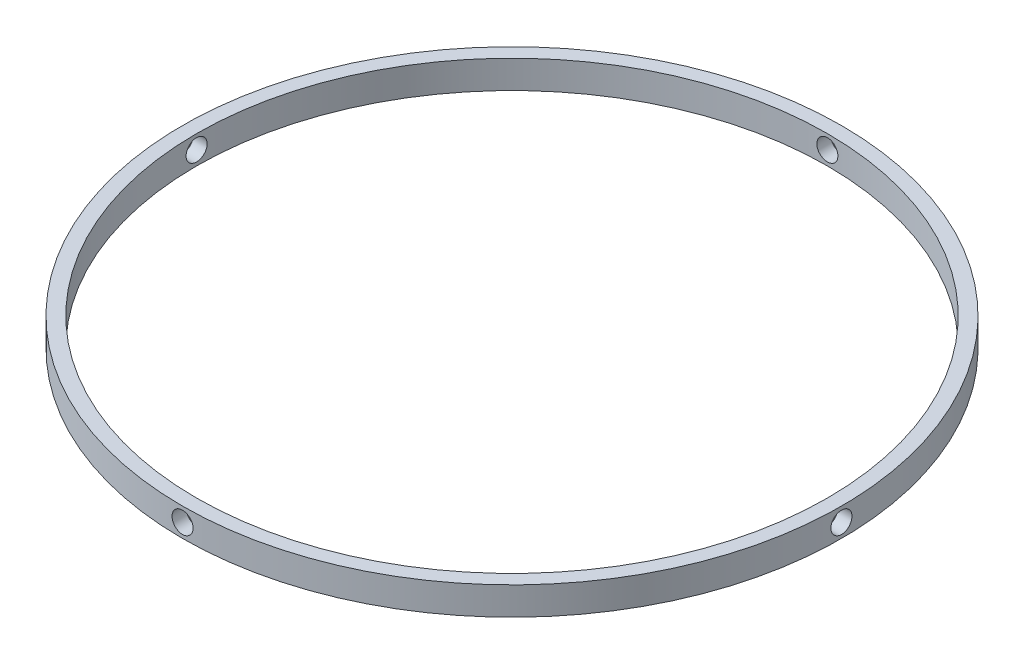
from build123d import *

# Parameters (mm, degrees)
SKETCH1_R               = 235
SKETCH1_R_2             = 225
BOSS_EXTRUDE1_DEPTH     = 20
CUT_EXTRUDE1_DEPTH      = 333.941436292
CUT_EXTRUDE1_DEPTH_BACK = 333.941436292
SKETCH2_R               = 7.5
CUT_EXTRUDE2_DEPTH      = 333.941436439
CUT_EXTRUDE2_DEPTH_BACK = 333.941436439
SKETCH3_R               = 7.5


with BuildPart() as part:
    # Sketch1 → Boss-Extrude1 (new body)
    with BuildSketch(Plane(origin=(0, 0, 0), x_dir=(1, 0, 0), z_dir=(0, 1, 0))):
        with Locations(Location((0, 0, 0), (0, 0, 270))):
            Circle(SKETCH1_R)
        with Locations(Location((0, 0, 0), (0, 0, 270))):
            Circle(SKETCH1_R_2, mode=Mode.SUBTRACT)
    extrude(amount=BOSS_EXTRUDE1_DEPTH)

    # Sketch2 → Cut-Extrude1 (cut, two sides: drawn at the far end of the back side and taken through both)
    with BuildSketch(Plane.XY.offset(-CUT_EXTRUDE1_DEPTH_BACK)):
        with Locations((0, 10)):
            Circle(SKETCH2_R)
    extrude(amount=CUT_EXTRUDE1_DEPTH + CUT_EXTRUDE1_DEPTH_BACK, mode=Mode.SUBTRACT)

    # Sketch3 → Cut-Extrude2 (cut, two sides: drawn at the far end of the back side and taken through both)
    with BuildSketch(Plane(origin=(0, 0, 0), x_dir=(0, 0, -1), z_dir=(1, 0, 0)).offset(-CUT_EXTRUDE2_DEPTH_BACK)):
        with Locations((0, 10)):
            Circle(SKETCH3_R)
    extrude(amount=CUT_EXTRUDE2_DEPTH + CUT_EXTRUDE2_DEPTH_BACK, mode=Mode.SUBTRACT)


solid = part.part
